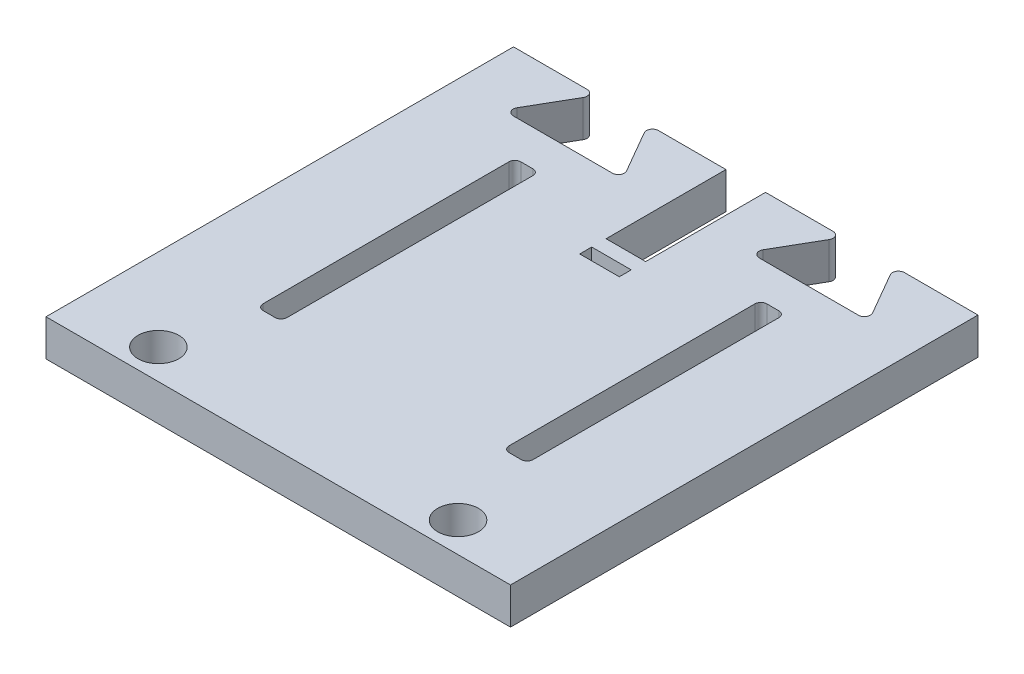
from build123d import *

# Parameters (mm, degrees)
BOSS_EXTRUDE1_DEPTH                = 3.05
FILLET3_R                          = 0.5
SKETCH2_W                          = 3.3
SKETCH2_H                          = 47
SKETCH2_H_2                        = 1
CUT_EXTRUDE1_DEPTH                 = 44.654245212
SKETCH6_W                          = 2
SKETCH6_H                          = 21.5
CUT_EXTRUDE2_DEPTH                 = 44.654245212
FILLET4_R                          = 0.5
M3_CLEARANCE_HEAD_MOUNTING_HOLES_D = 3.4


with BuildPart() as part:
    # Sketch1 → Boss-Extrude1 (new body)
    with BuildSketch(Plane(origin=(0, 0, 0), x_dir=(1, 0, 0), z_dir=(0, 1, 0))):
        Polygon((-19.375, 0), (-19.375, 39), (-12.375, 39), (-15.261751346, 34), (-5.261751346, 34), (-8.148502692, 39), (8.148502692, 39), (5.261751346, 34), (15.261751346, 34), (12.375, 39), (19.375, 39), (19.375, 0), align=None)
    extrude(amount=BOSS_EXTRUDE1_DEPTH)

    # Fillet3
    fillet3_edges = [part.edges().sort_by_distance(p)[0] for p in [
        (-12.375, 1.525, -39),
        (-15.261751346, 1.525, -34),
        (-5.261751346, 1.525, -34),
        (-8.148502692, 1.525, -39),
        (8.148502692, 1.525, -39),
        (5.261751346, 1.525, -34),
        (15.261751346, 1.525, -34),
        (12.375, 1.525, -39),
    ]]
    fillet(fillet3_edges, radius=FILLET3_R)

    # Sketch2 → Cut-Extrude1 (cut, through all)
    with BuildSketch(Plane(origin=(0, 3.05, 0), x_dir=(1, 0, 0), z_dir=(0, 1, 0))):
        with Locations((0, 52.5)):
            Rectangle(SKETCH2_W, SKETCH2_H)
        with Locations((0, 27.3)):
            Rectangle(SKETCH2_W, SKETCH2_H_2)
    extrude(amount=-CUT_EXTRUDE1_DEPTH, mode=Mode.SUBTRACT)

    # Sketch6 → Cut-Extrude2 (cut, through all)
    with BuildSketch(Plane(origin=(0, 3.05, 0), x_dir=(1, 0, 0), z_dir=(0, 1, 0))):
        with Locations((-10.261751346, 20.25)):
            Rectangle(SKETCH6_W, SKETCH6_H)
        with Locations((10.261751346, 20.25)):
            Rectangle(SKETCH6_W, SKETCH6_H)
    extrude(amount=-CUT_EXTRUDE2_DEPTH, mode=Mode.SUBTRACT)

    # Fillet4
    fillet4_edges = [part.edges().sort_by_distance(p)[0] for p in [
        (-11.261751346, 1.525, -9.5),
        (-11.261751346, 1.525, -31),
        (-9.261751346, 1.525, -31),
        (-9.261751346, 1.525, -9.5),
        (11.261751346, 1.525, -31),
        (11.261751346, 1.525, -9.5),
        (9.261751346, 1.525, -9.5),
        (9.261751346, 1.525, -31),
    ]]
    fillet(fillet4_edges, radius=FILLET4_R)

    # M3 Clearance Head Mounting Holes (through all)
    with Locations(Plane(origin=(0, 3.05, 0), x_dir=(1, 0, 0), z_dir=(0, 1, 0))):
        with Locations((-12.5, 2.5), (12.5, 2.5)):
            Hole(M3_CLEARANCE_HEAD_MOUNTING_HOLES_D / 2)


solid = part.part
